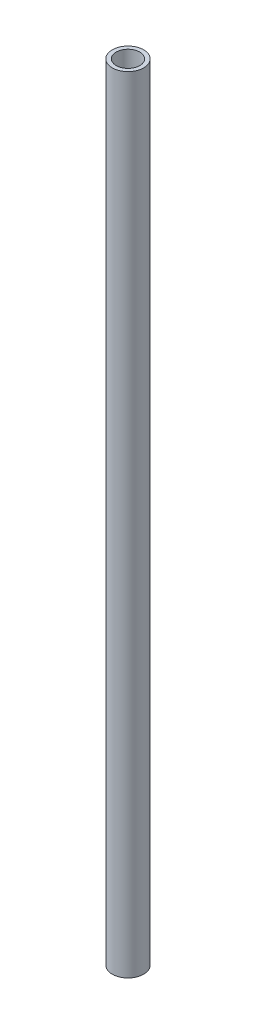
from build123d import *

# Parameters (mm, degrees)
SKETCH1_R           = 4
SKETCH1_R_2         = 3
BOSS_EXTRUDE1_DEPTH = 100


with BuildPart() as part:
    # Sketch1 → Boss-Extrude1 (new, symmetric)
    with BuildSketch(Plane(origin=(0, 0, 0), x_dir=(1, 0, 0), z_dir=(0, 1, 0))):
        with Locations(Location((0, 0, 0), (0, 0, 270))):
            Circle(SKETCH1_R)
        with Locations(Location((0, 0, 0), (0, 0, 270))):
            Circle(SKETCH1_R_2, mode=Mode.SUBTRACT)
    extrude(amount=BOSS_EXTRUDE1_DEPTH, both=True)


solid = part.part
